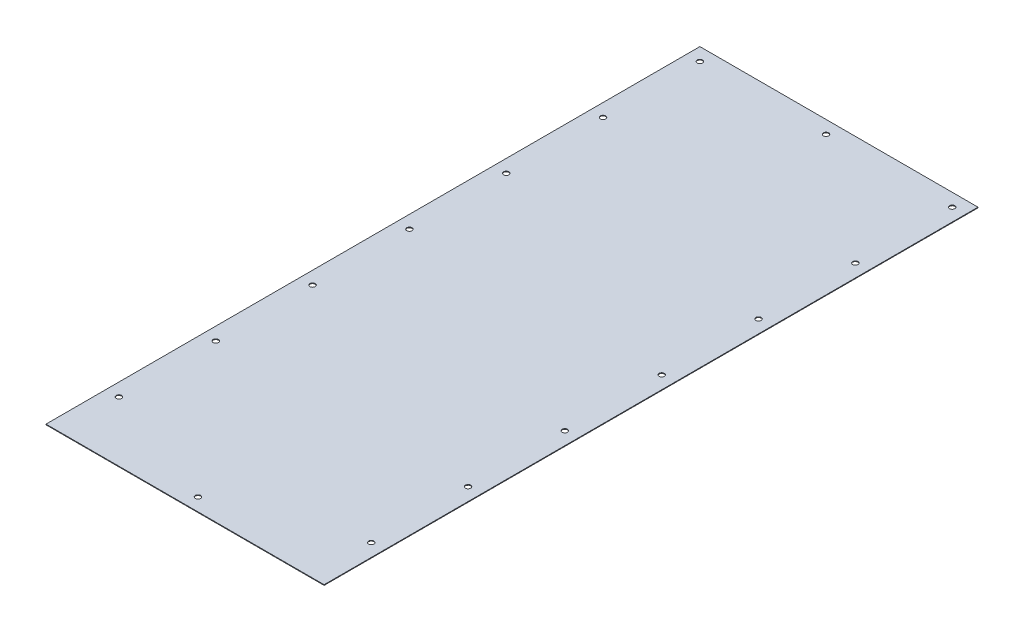
from build123d import *

# Parameters (mm, degrees)
SKETCH1_W           = 430.85
SKETCH1_H           = 1013
SKETCH1_R           = 4.1
BOSS_EXTRUDE1_DEPTH = 1


with BuildPart() as part:
    # Sketch1 → Boss-Extrude1 (new body)
    with BuildSketch(Plane(origin=(0, 0, 0), x_dir=(1, 0, 0), z_dir=(0, 1, 0))):
        Rectangle(SKETCH1_W, SKETCH1_H)
        with Locations(Location((-195.425, 486.5, 0), (0, 0, 270))):
            Circle(SKETCH1_R, mode=Mode.SUBTRACT)
        with Locations(Location((195.425, 486.5, 0), (0, 0, 270))):
            Circle(SKETCH1_R, mode=Mode.SUBTRACT)
        with Locations(Location((-195.425, 336.5, 0), (0, 0, 270))):
            Circle(SKETCH1_R, mode=Mode.SUBTRACT)
        with Locations(Location((195.425, 336.5, 0), (0, 0, 270))):
            Circle(SKETCH1_R, mode=Mode.SUBTRACT)
        with Locations(Location((-195.425, 186.5, 0), (0, 0, 270))):
            Circle(SKETCH1_R, mode=Mode.SUBTRACT)
        with Locations(Location((195.425, 186.5, 0), (0, 0, 270))):
            Circle(SKETCH1_R, mode=Mode.SUBTRACT)
        with Locations(Location((-195.425, 36.5, 0), (0, 0, 270))):
            Circle(SKETCH1_R, mode=Mode.SUBTRACT)
        with Locations(Location((195.425, 36.5, 0), (0, 0, 270))):
            Circle(SKETCH1_R, mode=Mode.SUBTRACT)
        with Locations(Location((-195.425, -113.5, 0), (0, 0, 270))):
            Circle(SKETCH1_R, mode=Mode.SUBTRACT)
        with Locations(Location((195.425, -113.5, 0), (0, 0, 270))):
            Circle(SKETCH1_R, mode=Mode.SUBTRACT)
        with Locations(Location((-195.425, -263.5, 0), (0, 0, 270))):
            Circle(SKETCH1_R, mode=Mode.SUBTRACT)
        with Locations(Location((195.425, -263.5, 0), (0, 0, 270))):
            Circle(SKETCH1_R, mode=Mode.SUBTRACT)
        with Locations(Location((-195.425, -413.5, 0), (0, 0, 270))):
            Circle(SKETCH1_R, mode=Mode.SUBTRACT)
        with Locations(Location((195.425, -413.5, 0), (0, 0, 270))):
            Circle(SKETCH1_R, mode=Mode.SUBTRACT)
        with Locations(Location((0, -486.5, 0), (0, 0, 270))):
            Circle(SKETCH1_R, mode=Mode.SUBTRACT)
        with Locations(Location((0, 486.5, 0), (0, 0, 270))):
            Circle(SKETCH1_R, mode=Mode.SUBTRACT)
    extrude(amount=BOSS_EXTRUDE1_DEPTH)


solid = part.part
